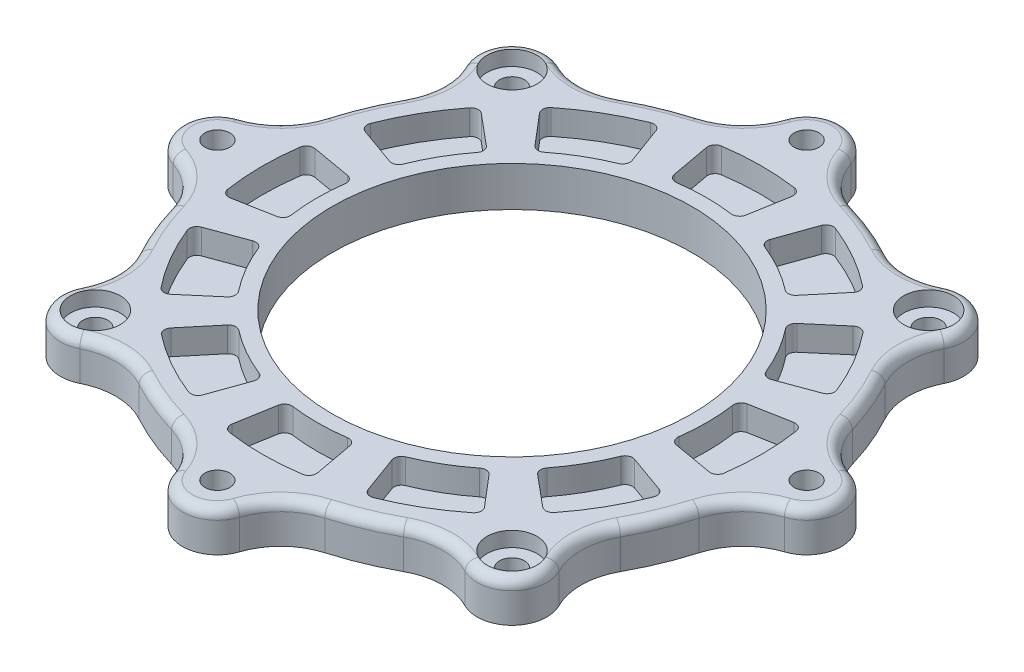
from build123d import *

# Parameters (mm, degrees)
SKETCH1_R           = 36
SKETCH1_R_2         = 2.5
BOSS_EXTRUDE1_DEPTH = 8
CUT_EXTRUDE2_DEPTH  = 5
FILLET1_R           = 2
SKETCH3_R           = 5
CUT_EXTRUDE3_DEPTH  = 3


with BuildPart() as part:
    # Sketch1 → Boss-Extrude1 (new body)
    with BuildSketch(Plane(origin=(0, 0, 0), x_dir=(1, 0, 0), z_dir=(0, 1, 0))):
        with BuildLine():
            ThreePointArc((-6.644035214, 61.203812889), (-9.963866552, 55.934132309), (-15.35386289, 52.81343479))
            ThreePointArc((-15.35386289, 52.81343479), (-21.04758878, 50.813374288), (-26.487917311, 48.201558445))
            ThreePointArc((-26.487917311, 48.201558445), (-32.50588665, 46.596921861), (-38.579588774, 47.975673483))
            ThreePointArc((-38.579588774, 47.975673483), (-46.669046785, 46.669046785), (-47.975673483, 38.579588774))
            ThreePointArc((-47.975673483, 38.579588774), (-46.596921861, 32.50588665), (-48.201558445, 26.487917311))
            ThreePointArc((-48.201558445, 26.487917311), (-50.813374288, 21.04758878), (-52.81343479, 15.35386289))
            ThreePointArc((-52.81343479, 15.35386289), (-55.934132309, 9.963866552), (-61.203812889, 6.644035214))
            ThreePointArc((-61.203812889, 6.644035214), (-65.999998906, 0), (-61.203812889, -6.644035214))
            ThreePointArc((-61.203812889, -6.644035214), (-55.934132309, -9.963866552), (-52.81343479, -15.35386289))
            ThreePointArc((-52.81343479, -15.35386289), (-50.813374288, -21.04758878), (-48.201558445, -26.487917311))
            ThreePointArc((-48.201558445, -26.487917311), (-46.596921861, -32.50588665), (-47.975673483, -38.579588774))
            ThreePointArc((-47.975673483, -38.579588774), (-46.669046785, -46.669046785), (-38.579588774, -47.975673483))
            ThreePointArc((-38.579588774, -47.975673483), (-32.50588665, -46.596921861), (-26.487917311, -48.201558445))
            ThreePointArc((-26.487917311, -48.201558445), (-21.04758878, -50.813374288), (-15.35386289, -52.81343479))
            ThreePointArc((-15.35386289, -52.81343479), (-9.963866552, -55.934132309), (-6.644035214, -61.203812889))
            ThreePointArc((-6.644035214, -61.203812889), (0, -65.999998906), (6.644035214, -61.203812889))
            ThreePointArc((6.644035214, -61.203812889), (9.963866552, -55.934132309), (15.35386289, -52.81343479))
            ThreePointArc((15.35386289, -52.81343479), (21.04758878, -50.813374288), (26.487917311, -48.201558445))
            ThreePointArc((26.487917311, -48.201558445), (32.50588665, -46.596921861), (38.579588774, -47.975673483))
            ThreePointArc((38.579588774, -47.975673483), (46.669046785, -46.669046785), (47.975673483, -38.579588774))
            ThreePointArc((47.975673483, -38.579588774), (46.596921861, -32.50588665), (48.201558445, -26.487917311))
            ThreePointArc((48.201558445, -26.487917311), (50.813374288, -21.04758878), (52.81343479, -15.35386289))
            ThreePointArc((52.81343479, -15.35386289), (55.934132309, -9.963866552), (61.203812889, -6.644035214))
            ThreePointArc((61.203812889, -6.644035214), (65.999998906, 0), (61.203812889, 6.644035214))
            ThreePointArc((61.203812889, 6.644035214), (55.934132309, 9.963866552), (52.81343479, 15.35386289))
            ThreePointArc((52.81343479, 15.35386289), (50.813374288, 21.04758878), (48.201558445, 26.487917311))
            ThreePointArc((48.201558445, 26.487917311), (46.596921861, 32.50588665), (47.975673483, 38.579588774))
            ThreePointArc((47.975673483, 38.579588774), (46.669046785, 46.669046785), (38.579588774, 47.975673483))
            ThreePointArc((38.579588774, 47.975673483), (32.50588665, 46.596921861), (26.487917311, 48.201558445))
            ThreePointArc((26.487917311, 48.201558445), (21.04758878, 50.813374288), (15.35386289, 52.81343479))
            ThreePointArc((15.35386289, 52.81343479), (9.963866552, 55.934132309), (6.644035214, 61.203812889))
            ThreePointArc((6.644035214, 61.203812889), (0, 65.999998906), (-6.644035214, 61.203812889))
        make_face()
        with Locations(Location((0, 0, 0), (0, 0, 270))):
            Circle(SKETCH1_R, mode=Mode.SUBTRACT)
        with Locations(Location((-41.719299316, 41.719299316, 0), (0, 0, 270))):
            Circle(SKETCH1_R_2, mode=Mode.SUBTRACT)
        with Locations(Location((0, 58.999998906, 0), (0, 0, 270))):
            Circle(SKETCH1_R_2, mode=Mode.SUBTRACT)
        with Locations(Location((41.719299316, 41.719299316, 0), (0, 0, 270))):
            Circle(SKETCH1_R_2, mode=Mode.SUBTRACT)
        with Locations(Location((58.999998906, 0, 0), (0, 0, 270))):
            Circle(SKETCH1_R_2, mode=Mode.SUBTRACT)
        with Locations(Location((41.719299316, -41.719299316, 0), (0, 0, 270))):
            Circle(SKETCH1_R_2, mode=Mode.SUBTRACT)
        with Locations(Location((0, -58.999998906, 0), (0, 0, 270))):
            Circle(SKETCH1_R_2, mode=Mode.SUBTRACT)
        with Locations(Location((-41.719299316, -41.719299316, 0), (0, 0, 270))):
            Circle(SKETCH1_R_2, mode=Mode.SUBTRACT)
        with Locations(Location((-58.999998906, 0, 0), (0, 0, 270))):
            Circle(SKETCH1_R_2, mode=Mode.SUBTRACT)
    extrude(amount=-BOSS_EXTRUDE1_DEPTH)

    # Sketch2 → Cut-Extrude2 (cut)
    with BuildSketch(Plane(origin=(0, 0, 0), x_dir=(1, 0, 0), z_dir=(0, 1, 0))):
        with BuildLine():
            Line((-45.665271257, 16.269081136), (-38.124930383, 13.582697937))
            ThreePointArc((-38.124930383, 13.582697937), (-37.003550083, 13.628913449), (-36.228132398, 14.440305502))
            ThreePointArc((-36.228132398, 14.440305502), (-33.866420308, 19.340774946), (-30.84580963, 23.864953976))
            ThreePointArc((-30.84580963, 23.864953976), (-30.54098913, 24.945099389), (-31.070993944, 25.934404473))
            Line((-31.070993944, 25.934404473), (-37.216208722, 31.063705644))
            ThreePointArc((-37.216208722, 31.063705644), (-38.335105865, 31.403824755), (-39.358146084, 30.837255663))
            ThreePointArc((-39.358146084, 30.837255663), (-43.418487575, 24.795865315), (-46.558621628, 18.228953676))
            ThreePointArc((-46.558621628, 18.228953676), (-46.526756265, 17.059938524), (-45.665271257, 16.269081136))
        make_face()
        with BuildLine():
            Line((-31.412744411, 36.922073189), (-26.225809261, 30.825426657))
            ThreePointArc((-26.225809261, 30.825426657), (-25.231557678, 30.304760314), (-24.154330237, 30.619737602))
            ThreePointArc((-24.154330237, 30.619737602), (-19.658792849, 33.682812586), (-14.780777752, 36.090561218))
            ThreePointArc((-14.780777752, 36.090561218), (-13.976722749, 36.873584336), (-13.94106784, 37.995350077))
            Line((-13.94106784, 37.995350077), (-16.698329364, 45.510062585))
            ThreePointArc((-16.698329364, 45.510062585), (-17.497263158, 46.364062947), (-18.666526523, 46.384919829))
            ThreePointArc((-18.666526523, 46.384919829), (-25.203580576, 43.183093059), (-31.206472257, 39.066047782))
            ThreePointArc((-31.206472257, 39.066047782), (-31.763383619, 38.037718281), (-31.412744411, 36.922073189))
        make_face()
        with BuildLine():
            Line((-8.743198069, 47.681825547), (-7.299503726, 39.808507198))
            ThreePointArc((-7.299503726, 39.808507198), (-6.698789769, 38.860471127), (-5.608394796, 38.594635739))
            ThreePointArc((-5.608394796, 38.594635739), (-0.183607722, 38.999567795), (5.244751589, 38.645731728))
            ThreePointArc((5.244751589, 38.645731728), (6.332595206, 38.921822138), (6.924356134, 39.875472312))
            Line((6.924356134, 39.875472312), (8.293853863, 47.762035008))
            ThreePointArc((8.293853863, 47.762035008), (8.028957081, 48.901087914), (7.026773745, 49.503782186))
            ThreePointArc((7.026773745, 49.503782186), (-0.235394516, 49.999445891), (-7.492573846, 49.435425933))
            ThreePointArc((-7.492573846, 49.435425933), (-8.489037983, 48.823322143), (-8.743198069, 47.681825547))
        make_face()
        with BuildLine():
            Line((16.269081136, 45.665271257), (13.582697937, 38.124930383))
            ThreePointArc((13.582697937, 38.124930383), (13.628913449, 37.003550083), (14.440305502, 36.228132398))
            ThreePointArc((14.440305502, 36.228132398), (19.340774946, 33.866420308), (23.864953976, 30.84580963))
            ThreePointArc((23.864953976, 30.84580963), (24.945099389, 30.54098913), (25.934404473, 31.070993944))
            Line((25.934404473, 31.070993944), (31.063705644, 37.216208722))
            ThreePointArc((31.063705644, 37.216208722), (31.403824755, 38.335105865), (30.837255663, 39.358146084))
            ThreePointArc((30.837255663, 39.358146084), (24.795865315, 43.418487575), (18.228953676, 46.558621628))
            ThreePointArc((18.228953676, 46.558621628), (17.059938524, 46.526756265), (16.269081136, 45.665271257))
        make_face()
        with BuildLine():
            Line((36.922073189, 31.412744411), (30.825426657, 26.225809261))
            ThreePointArc((30.825426657, 26.225809261), (30.304760314, 25.231557678), (30.619737602, 24.154330237))
            ThreePointArc((30.619737602, 24.154330237), (33.682812586, 19.658792849), (36.090561218, 14.780777752))
            ThreePointArc((36.090561218, 14.780777752), (36.873584336, 13.976722749), (37.995350077, 13.94106784))
            Line((37.995350077, 13.94106784), (45.510062585, 16.698329364))
            ThreePointArc((45.510062585, 16.698329364), (46.364062947, 17.497263158), (46.384919829, 18.666526523))
            ThreePointArc((46.384919829, 18.666526523), (43.183093059, 25.203580576), (39.066047782, 31.206472257))
            ThreePointArc((39.066047782, 31.206472257), (38.037718281, 31.763383619), (36.922073189, 31.412744411))
        make_face()
        with BuildLine():
            Line((47.681825547, 8.743198069), (39.808507198, 7.299503726))
            ThreePointArc((39.808507198, 7.299503726), (38.860471127, 6.698789769), (38.594635739, 5.608394796))
            ThreePointArc((38.594635739, 5.608394796), (38.999567795, 0.183607722), (38.645731728, -5.244751589))
            ThreePointArc((38.645731728, -5.244751589), (38.921822138, -6.332595206), (39.875472312, -6.924356134))
            Line((39.875472312, -6.924356134), (47.762035008, -8.293853863))
            ThreePointArc((47.762035008, -8.293853863), (48.901087914, -8.028957081), (49.503782186, -7.026773745))
            ThreePointArc((49.503782186, -7.026773745), (49.999445891, 0.235394516), (49.435425933, 7.492573846))
            ThreePointArc((49.435425933, 7.492573846), (48.823322143, 8.489037983), (47.681825547, 8.743198069))
        make_face()
        with BuildLine():
            Line((45.665271257, -16.269081136), (38.124930383, -13.582697937))
            ThreePointArc((38.124930383, -13.582697937), (37.003550083, -13.628913449), (36.228132398, -14.440305502))
            ThreePointArc((36.228132398, -14.440305502), (33.866420308, -19.340774946), (30.84580963, -23.864953976))
            ThreePointArc((30.84580963, -23.864953976), (30.54098913, -24.945099389), (31.070993944, -25.934404473))
            Line((31.070993944, -25.934404473), (37.216208722, -31.063705644))
            ThreePointArc((37.216208722, -31.063705644), (38.335105865, -31.403824755), (39.358146084, -30.837255663))
            ThreePointArc((39.358146084, -30.837255663), (43.418487575, -24.795865315), (46.558621628, -18.228953676))
            ThreePointArc((46.558621628, -18.228953676), (46.526756265, -17.059938524), (45.665271257, -16.269081136))
        make_face()
        with BuildLine():
            Line((31.412744411, -36.922073189), (26.225809261, -30.825426657))
            ThreePointArc((26.225809261, -30.825426657), (25.231557678, -30.304760314), (24.154330237, -30.619737602))
            ThreePointArc((24.154330237, -30.619737602), (19.658792849, -33.682812586), (14.780777752, -36.090561218))
            ThreePointArc((14.780777752, -36.090561218), (13.976722749, -36.873584336), (13.94106784, -37.995350077))
            Line((13.94106784, -37.995350077), (16.698329364, -45.510062585))
            ThreePointArc((16.698329364, -45.510062585), (17.497263158, -46.364062947), (18.666526523, -46.384919829))
            ThreePointArc((18.666526523, -46.384919829), (25.203580576, -43.183093059), (31.206472257, -39.066047782))
            ThreePointArc((31.206472257, -39.066047782), (31.763383619, -38.037718281), (31.412744411, -36.922073189))
        make_face()
        with BuildLine():
            Line((8.743198069, -47.681825547), (7.299503726, -39.808507198))
            ThreePointArc((7.299503726, -39.808507198), (6.698789769, -38.860471127), (5.608394796, -38.594635739))
            ThreePointArc((5.608394796, -38.594635739), (0.183607722, -38.999567795), (-5.244751589, -38.645731728))
            ThreePointArc((-5.244751589, -38.645731728), (-6.332595206, -38.921822138), (-6.924356134, -39.875472312))
            Line((-6.924356134, -39.875472312), (-8.293853863, -47.762035008))
            ThreePointArc((-8.293853863, -47.762035008), (-8.028957081, -48.901087914), (-7.026773745, -49.503782186))
            ThreePointArc((-7.026773745, -49.503782186), (0.235394516, -49.999445891), (7.492573846, -49.435425933))
            ThreePointArc((7.492573846, -49.435425933), (8.489037983, -48.823322143), (8.743198069, -47.681825547))
        make_face()
        with BuildLine():
            Line((-16.269081136, -45.665271257), (-13.582697937, -38.124930383))
            ThreePointArc((-13.582697937, -38.124930383), (-13.628913449, -37.003550083), (-14.440305502, -36.228132398))
            ThreePointArc((-14.440305502, -36.228132398), (-19.340774946, -33.866420308), (-23.864953976, -30.84580963))
            ThreePointArc((-23.864953976, -30.84580963), (-24.945099389, -30.54098913), (-25.934404473, -31.070993944))
            Line((-25.934404473, -31.070993944), (-31.063705644, -37.216208722))
            ThreePointArc((-31.063705644, -37.216208722), (-31.403824755, -38.335105865), (-30.837255663, -39.358146084))
            ThreePointArc((-30.837255663, -39.358146084), (-24.795865315, -43.418487575), (-18.228953676, -46.558621628))
            ThreePointArc((-18.228953676, -46.558621628), (-17.059938524, -46.526756265), (-16.269081136, -45.665271257))
        make_face()
        with BuildLine():
            Line((-36.922073189, -31.412744411), (-30.825426657, -26.225809261))
            ThreePointArc((-30.825426657, -26.225809261), (-30.304760314, -25.231557678), (-30.619737602, -24.154330237))
            ThreePointArc((-30.619737602, -24.154330237), (-33.682812586, -19.658792849), (-36.090561218, -14.780777752))
            ThreePointArc((-36.090561218, -14.780777752), (-36.873584336, -13.976722749), (-37.995350077, -13.94106784))
            Line((-37.995350077, -13.94106784), (-45.510062585, -16.698329364))
            ThreePointArc((-45.510062585, -16.698329364), (-46.364062947, -17.497263158), (-46.384919829, -18.666526523))
            ThreePointArc((-46.384919829, -18.666526523), (-43.183093059, -25.203580576), (-39.066047782, -31.206472257))
            ThreePointArc((-39.066047782, -31.206472257), (-38.037718281, -31.763383619), (-36.922073189, -31.412744411))
        make_face()
        with BuildLine():
            Line((-47.681825547, -8.743198069), (-39.808507198, -7.299503726))
            ThreePointArc((-39.808507198, -7.299503726), (-38.860471127, -6.698789769), (-38.594635739, -5.608394796))
            ThreePointArc((-38.594635739, -5.608394796), (-38.999567795, -0.183607722), (-38.645731728, 5.244751589))
            ThreePointArc((-38.645731728, 5.244751589), (-38.921822138, 6.332595206), (-39.875472312, 6.924356134))
            Line((-39.875472312, 6.924356134), (-47.762035008, 8.293853863))
            ThreePointArc((-47.762035008, 8.293853863), (-48.901087914, 8.028957081), (-49.503782186, 7.026773745))
            ThreePointArc((-49.503782186, 7.026773745), (-49.999445891, -0.235394516), (-49.435425933, -7.492573846))
            ThreePointArc((-49.435425933, -7.492573846), (-48.823322143, -8.489037983), (-47.681825547, -8.743198069))
        make_face()
    extrude(amount=-CUT_EXTRUDE2_DEPTH, mode=Mode.SUBTRACT)

    # Fillet1
    fillet1_edges = [part.edges().sort_by_distance(p)[0] for p in [
        (0, 0, -65.999998906),
        (9.963866552, 0, -55.934132309),
        (21.04758878, 0, -50.813374288),
        (32.50588665, 0, -46.596921861),
        (46.669046785, 0, -46.669046785),
        (46.596921861, 0, -32.50588665),
        (50.813374288, 0, -21.04758878),
        (55.934132309, 0, -9.963866552),
        (65.999998906, 0, 0),
        (55.934132309, 0, 9.963866552),
        (50.813374288, 0, 21.04758878),
        (46.596921861, 0, 32.50588665),
        (46.669046785, 0, 46.669046785),
        (32.50588665, 0, 46.596921861),
        (21.04758878, 0, 50.813374288),
        (9.963866552, 0, 55.934132309),
        (0, 0, 65.999998906),
        (-9.963866552, 0, 55.934132309),
        (-21.04758878, 0, 50.813374288),
        (-32.50588665, 0, 46.596921861),
        (-46.669046785, 0, 46.669046785),
        (-46.596921861, 0, 32.50588665),
        (-50.813374288, 0, 21.04758878),
        (-55.934132309, 0, 9.963866552),
        (-65.999998906, 0, 0),
        (-55.934132309, 0, -9.963866552),
        (-50.813374288, 0, -21.04758878),
        (-46.596921861, 0, -32.50588665),
        (-46.669046785, 0, -46.669046785),
        (-32.50588665, 0, -46.596921861),
        (-21.04758878, 0, -50.813374288),
        (-9.963866552, 0, -55.934132309),
    ]]
    fillet(fillet1_edges, radius=FILLET1_R)

    # Sketch3 → Cut-Extrude3 (cut)
    with BuildSketch(Plane(origin=(0, 0, 0), x_dir=(1, 0, 0), z_dir=(0, 1, 0))):
        with Locations(Location((-41.719299316, -41.719299316, 0), (0, 0, 270))):
            Circle(SKETCH3_R)
        with Locations(Location((-41.719299316, 41.719299316, 0), (0, 0, 270))):
            Circle(SKETCH3_R)
        with Locations(Location((41.719299316, 41.719299316, 0), (0, 0, 270))):
            Circle(SKETCH3_R)
        with Locations(Location((41.719299316, -41.719299316, 0), (0, 0, 270))):
            Circle(SKETCH3_R)
    extrude(amount=-CUT_EXTRUDE3_DEPTH, mode=Mode.SUBTRACT)


solid = part.part
